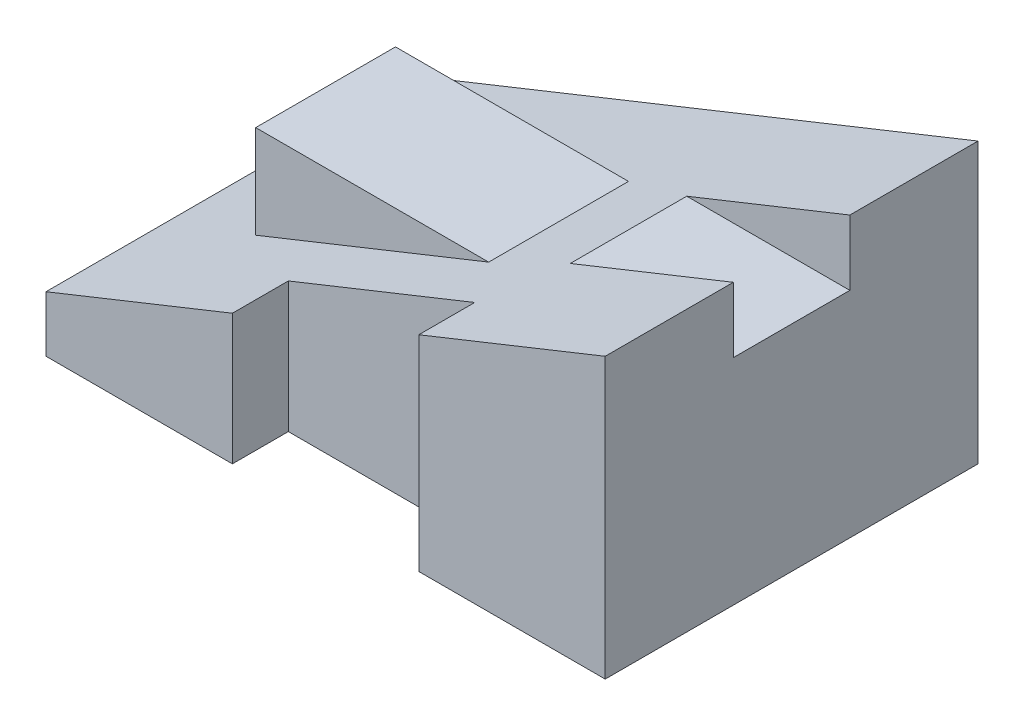
from build123d import *

# Parameters (mm, degrees)
BOSS_EXTRUDE1_DEPTH = 60
CUT_EXTRUDE2_DEPTH  = 40
SKETCH8_W           = 100
SKETCH8_H           = 30
BOSS_EXTRUDE2_DEPTH = 40
SKETCH9_W           = 25
SKETCH9_H           = 14
CUT_EXTRUDE3_DEPTH  = 94.808315196


with BuildPart() as part:
    # Sketch1 → Boss-Extrude1 (new body)
    with BuildSketch(Plane(origin=(0, 0, 0), x_dir=(1, 0, 0), z_dir=(0, 1, 0))):
        Polygon((-20, -28), (-20, -40), (-60, -40), (-60, 40), (60, 40), (60, -40), (20, -40), (20, -28), align=None)
    extrude(amount=BOSS_EXTRUDE1_DEPTH)

    # Sketch7 → Cut-Extrude2 (cut, symmetric)
    with BuildSketch(Plane.XY):
        Polygon((60, 60), (-60, 12), (-60, 60), align=None)
    extrude(amount=CUT_EXTRUDE2_DEPTH, both=True, mode=Mode.SUBTRACT)

    # Sketch8 → Boss-Extrude2 (add)
    with BuildSketch(Plane(origin=(0, 0, 0), x_dir=(1, 0, 0), z_dir=(0, 1, 0))):
        with Locations((10, 0)):
            Rectangle(SKETCH8_W, SKETCH8_H)
    extrude(amount=BOSS_EXTRUDE2_DEPTH)

    # Sketch9 → Cut-Extrude3 (cut, through all)
    with BuildSketch(Plane(origin=(0, 0, 0), x_dir=(0, 0, -1), z_dir=(1, 0, 0))):
        with Locations((0, 53)):
            Rectangle(SKETCH9_W, SKETCH9_H)
    extrude(amount=CUT_EXTRUDE3_DEPTH, mode=Mode.SUBTRACT)


solid = part.part
